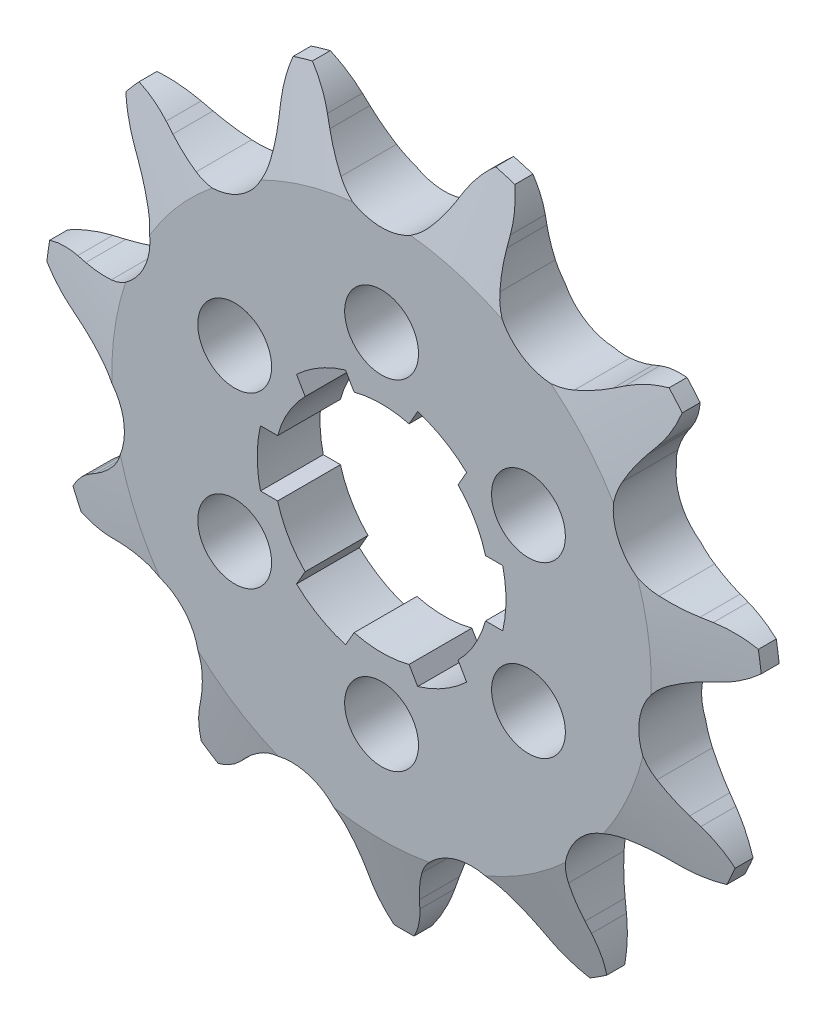
from build123d import *

# Parameters (mm, degrees)
CUT_EXTRUDE1_DEPTH      = 46.050861773
CIRPATTERN1_COUNT       = 11
CUT_EXTRUDE2_DEPTH      = 45.903287026
CUT_EXTRUDE2_DEPTH_BACK = 45.903287026
SKETCH3_OUTSIDE_W       = 82.986
SKETCH3_OUTSIDE_H       = 82.355
SKETCH3_OUTSIDE_R       = 36.957
SKETCH3_OUTSIDE_R_2     = 8.5
CUT_EXTRUDE4_DEPTH      = 46.160371144
SKETCH15_R              = 3.2639
CUT_EXTRUDE5_DEPTH      = 46.160371144
CUT_EXTRUDE6_DEPTH      = 45.903403069
CUT_EXTRUDE6_DEPTH_BACK = 45.903403069
SKETCH16_R              = 9.525


with BuildPart() as part:
    # Sketch1 → Revolve1 (revolve)
    with BuildSketch(Plane(origin=(0, 0, 0), x_dir=(0, 0, -1), z_dir=(1, 0, 0)), mode=Mode.PRIVATE) as revolve1_sk:
        Polygon((2.778125, 0), (-2.778125, 0), (-2.778125, 23.857642459), (-0.79375, 31.795142459), (0.79375, 31.795142459), (2.778125, 23.857642459), align=None)
    revolve(revolve1_sk.sketch.rotate(Axis((0, 0, -2.778125), (0, 0, 1)), 90), axis=Axis((0, 0, -2.778125), (0, 0, 1)))

    # Sketch0 → Cut-Extrude1 (cut, symmetric)
    with BuildSketch(Plane.XY):
        with BuildLine():
            Line((13.704056458, -25.310310757), (13.050398427, -24.631275233))
            ThreePointArc((13.050398427, -24.631275233), (11.95512537, -23.614779328), (10.752525531, -22.727851696))
            ThreePointArc((10.752525531, -22.727851696), (6.488408594, -22.097490349), (3.24200423, -24.933139726))
            ThreePointArc((3.24200423, -24.933139726), (2.709822147, -26.329445289), (2.337978996, -27.776725382))
            Line((2.337978996, -27.776725382), (2.155201188, -28.701360627))
            ThreePointArc((2.155201188, -28.701360627), (-1.617083023, -34.260607897), (-8.235613288, -35.414044291))
            ThreePointArc((-8.235613288, -35.414044291), (10.243525573, -34.886244325), (26.074516628, -25.339681171))
            ThreePointArc((26.074516628, -25.339681171), (19.883059866, -27.947596343), (13.704056458, -25.310310757))
        make_face()
    cut_extrude1 = extrude(amount=CUT_EXTRUDE1_DEPTH, both=True, mode=Mode.SUBTRACT)

    # CirPattern1: Cut-Extrude1 ×11 about axis
    cirpattern1_axis = Axis((0, 0, 0), (0, 0, 1))
    for i in range(1, CIRPATTERN1_COUNT):
        add(cut_extrude1.rotate(cirpattern1_axis, i * 360 / CIRPATTERN1_COUNT), mode=Mode.SUBTRACT)

    # Sketch3 outside → Cut-Extrude2 (cut, two sides: drawn at the far end of the back side and taken through both)
    # profile 1 of 2: a face of its own
    with BuildSketch(Plane.XY.offset(-CUT_EXTRUDE2_DEPTH_BACK)):
        with Locations((0, -0.5245)):
            Rectangle(SKETCH3_OUTSIDE_W, SKETCH3_OUTSIDE_H)
        Circle(SKETCH3_OUTSIDE_R, mode=Mode.SUBTRACT)
    # profile 2 of 2: a face of its own
    with BuildSketch(Plane.XY.offset(-CUT_EXTRUDE2_DEPTH_BACK)):
        Circle(SKETCH3_OUTSIDE_R_2)
    extrude(amount=CUT_EXTRUDE2_DEPTH + CUT_EXTRUDE2_DEPTH_BACK, mode=Mode.SUBTRACT)

    # Sketch12 → Cut-Extrude4 (cut, through all)
    with BuildSketch(Plane(origin=(0, 0, -2.778125), x_dir=(-1, 0, 0), z_dir=(0, 0, -1))):
        with BuildLine():
            Line((10.712142643, 2.5), (8.645808233, 2.5))
            ThreePointArc((8.645808233, 2.5), (7.794228634, 4.5), (6.487967626, 6.237489566))
            Line((6.487967626, 6.237489566), (7.521134831, 8.026987658))
            ThreePointArc((7.521134831, 8.026987658), (5.5, 9.526279442), (3.191007812, 10.526987658))
            Line((3.191007812, 10.526987658), (2.157840607, 8.737489566))
            ThreePointArc((2.157840607, 8.737489566), (0, 9), (-2.157840607, 8.737489566))
            Line((-2.157840607, 8.737489566), (-3.191007812, 10.526987658))
            ThreePointArc((-3.191007812, 10.526987658), (-5.5, 9.526279442), (-7.521134831, 8.026987658))
            Line((-7.521134831, 8.026987658), (-6.487967626, 6.237489566))
            ThreePointArc((-6.487967626, 6.237489566), (-7.794228634, 4.5), (-8.645808233, 2.5))
            Line((-8.645808233, 2.5), (-10.712142643, 2.5))
            ThreePointArc((-10.712142643, 2.5), (-11, 0), (-10.712142643, -2.5))
            Line((-10.712142643, -2.5), (-8.645808233, -2.5))
            ThreePointArc((-8.645808233, -2.5), (-7.794228634, -4.5), (-6.487967626, -6.237489566))
            Line((-6.487967626, -6.237489566), (-7.521134831, -8.026987658))
            ThreePointArc((-7.521134831, -8.026987658), (-5.5, -9.526279442), (-3.191007812, -10.526987658))
            Line((-3.191007812, -10.526987658), (-2.157840607, -8.737489566))
            ThreePointArc((-2.157840607, -8.737489566), (0, -9), (2.157840607, -8.737489566))
            Line((2.157840607, -8.737489566), (3.191007812, -10.526987658))
            ThreePointArc((3.191007812, -10.526987658), (5.5, -9.526279442), (7.521134831, -8.026987658))
            Line((7.521134831, -8.026987658), (6.487967626, -6.237489566))
            ThreePointArc((6.487967626, -6.237489566), (7.794228634, -4.5), (8.645808233, -2.5))
            Line((8.645808233, -2.5), (10.712142643, -2.5))
            ThreePointArc((10.712142643, -2.5), (11, 0), (10.712142643, 2.5))
        make_face()
    extrude(amount=-CUT_EXTRUDE4_DEPTH, mode=Mode.SUBTRACT)

    # Sketch15 → Cut-Extrude5 (cut, through all)
    with BuildSketch(Plane.XY.offset(2.778125)):
        with Locations((0, 15)):
            Circle(SKETCH15_R)
        with Locations((12.990381057, 7.5)):
            Circle(SKETCH15_R)
        with Locations((12.990381057, -7.5)):
            Circle(SKETCH15_R)
        with Locations((0, -15)):
            Circle(SKETCH15_R)
        with Locations((-12.990381057, -7.5)):
            Circle(SKETCH15_R)
        with Locations((-12.990381057, 7.5)):
            Circle(SKETCH15_R)
    extrude(amount=-CUT_EXTRUDE5_DEPTH, mode=Mode.SUBTRACT)

    # Sketch16 → Cut-Extrude6 (cut, two sides: drawn at the far end of the back side and taken through both)
    with BuildSketch(Plane.XY.offset(-0.001875).offset(-CUT_EXTRUDE6_DEPTH_BACK)):
        Circle(SKETCH16_R)
    extrude(amount=CUT_EXTRUDE6_DEPTH + CUT_EXTRUDE6_DEPTH_BACK, mode=Mode.SUBTRACT)


solid = part.part
